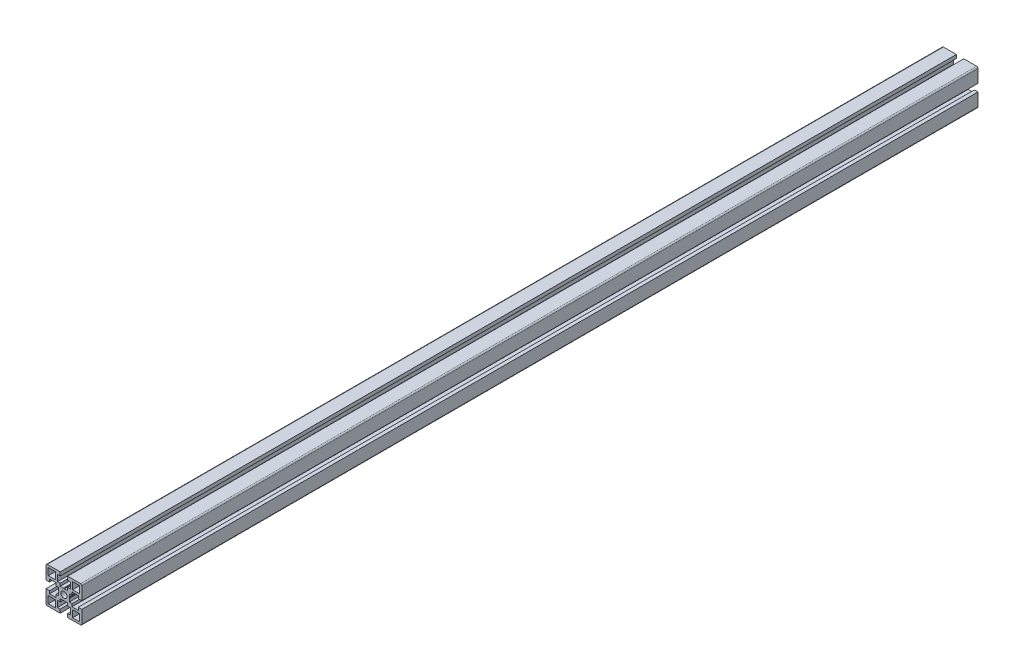
from build123d import *

# Parameters (mm, degrees)
SKETCH1_R           = 3.4
SKETCH1_W           = 7.85
SKETCH1_H           = 7.85
BOSS_EXTRUDE1_DEPTH = 1000


with BuildPart() as part:
    # Sketch1 → Boss-Extrude1 (new body)
    with BuildSketch(Plane.XY):
        with BuildLine():
            Line((-7.15, 16), (-4.15, 16))
            Line((-4.15, 16), (-4.15, 20))
            Line((-4.15, 20), (-18.5, 20))
            ThreePointArc((-18.5, 20), (-19.560660172, 19.560660172), (-20, 18.5))
            Line((-20, 18.5), (-20, 4.15))
            Line((-20, 4.15), (-16, 4.15))
            Line((-16, 4.15), (-16, 7.15))
            Line((-16, 7.15), (-9, 7.15))
            Line((-9, 7.15), (-9, 4.15))
            Line((-9, 4.15), (-6, 4.15))
            Line((-6, 4.15), (-6, 0.519615242))
            Line((-6, 0.519615242), (-5.7, 0))
            Line((-5.7, 0), (-6, -0.519615242))
            Line((-6, -0.519615242), (-6, -4.15))
            Line((-6, -4.15), (-9, -4.15))
            Line((-9, -4.15), (-9, -7.15))
            Line((-9, -7.15), (-16, -7.15))
            Line((-16, -7.15), (-16, -4.15))
            Line((-16, -4.15), (-20, -4.15))
            Line((-20, -4.15), (-20, -18.5))
            ThreePointArc((-20, -18.5), (-19.560660172, -19.560660172), (-18.5, -20))
            Line((-18.5, -20), (-4.15, -20))
            Line((-4.15, -20), (-4.15, -16))
            Line((-4.15, -16), (-7.15, -16))
            Line((-7.15, -16), (-7.15, -9))
            Line((-7.15, -9), (-4.15, -9))
            Line((-4.15, -9), (-4.15, -6))
            Line((-4.15, -6), (-0.519615242, -6))
            Line((-0.519615242, -6), (0, -5.7))
            Line((0, -5.7), (0.519615242, -6))
            Line((0.519615242, -6), (4.15, -6))
            Line((4.15, -6), (4.15, -9))
            Line((4.15, -9), (7.15, -9))
            Line((7.15, -9), (7.15, -16))
            Line((7.15, -16), (4.15, -16))
            Line((4.15, -16), (4.15, -20))
            Line((4.15, -20), (18.5, -20))
            ThreePointArc((18.5, -20), (19.560660172, -19.560660172), (20, -18.5))
            Line((20, -18.5), (20, -4.15))
            Line((20, -4.15), (16, -4.15))
            Line((16, -4.15), (16, -7.15))
            Line((16, -7.15), (9, -7.15))
            Line((9, -7.15), (9, -4.15))
            Line((9, -4.15), (6, -4.15))
            Line((6, -4.15), (6, -0.519615242))
            Line((6, -0.519615242), (5.7, 0))
            Line((5.7, 0), (6, 0.519615242))
            Line((6, 0.519615242), (6, 4.15))
            Line((6, 4.15), (9, 4.15))
            Line((9, 4.15), (9, 7.15))
            Line((9, 7.15), (16, 7.15))
            Line((16, 7.15), (16, 4.15))
            Line((16, 4.15), (20, 4.15))
            Line((20, 4.15), (20, 18.5))
            ThreePointArc((20, 18.5), (19.560660172, 19.560660172), (18.5, 20))
            Line((18.5, 20), (4.15, 20))
            Line((4.15, 20), (4.15, 16))
            Line((4.15, 16), (7.15, 16))
            Line((7.15, 16), (7.15, 9))
            Line((7.15, 9), (4.15, 9))
            Line((4.15, 9), (4.15, 6))
            Line((4.15, 6), (0.519615242, 6))
            Line((0.519615242, 6), (0, 5.7))
            Line((0, 5.7), (-0.519615242, 6))
            Line((-0.519615242, 6), (-4.15, 6))
            Line((-4.15, 6), (-4.15, 9))
            Line((-4.15, 9), (-7.15, 9))
            Line((-7.15, 9), (-7.15, 16))
        make_face()
        with Locations(Location((0, 0, 0), (0, 0, 180))):
            Circle(SKETCH1_R, mode=Mode.SUBTRACT)
        with Locations((-13.575, 13.575)):
            Rectangle(SKETCH1_W, SKETCH1_H, mode=Mode.SUBTRACT)
        with Locations((13.575, 13.575)):
            Rectangle(SKETCH1_W, SKETCH1_H, mode=Mode.SUBTRACT)
        with Locations((-13.575, -13.575)):
            Rectangle(SKETCH1_W, SKETCH1_H, mode=Mode.SUBTRACT)
        with Locations((13.575, -13.575)):
            Rectangle(SKETCH1_W, SKETCH1_H, mode=Mode.SUBTRACT)
    extrude(amount=-BOSS_EXTRUDE1_DEPTH)


solid = part.part
